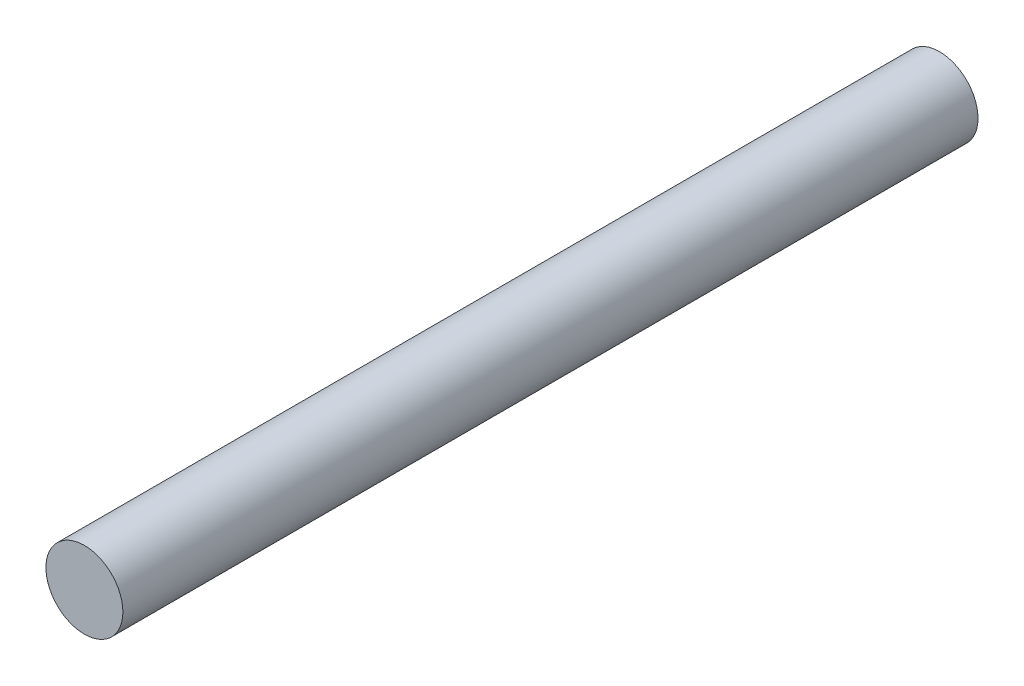
from build123d import *

# Parameters (mm, degrees)
SKETCH_1_R      = 0.9
EXTRUDE_1_DEPTH = 20


with BuildPart() as part:
    # 草图1 → 凸台-拉伸1 (new body)
    with BuildSketch(Plane.XY):
        Circle(SKETCH_1_R)
    extrude(amount=EXTRUDE_1_DEPTH)


solid = part.part
